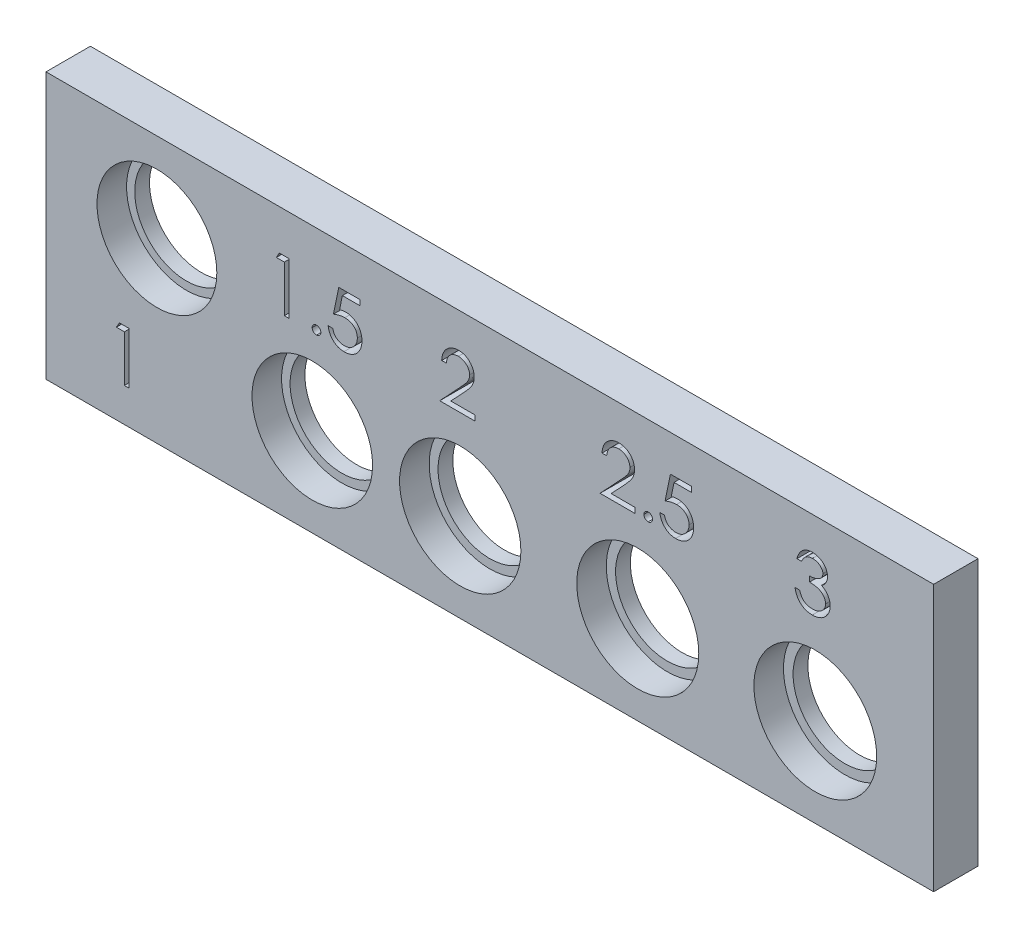
from build123d import *

# Parameters (mm, degrees)
SKETCH1_W           = 60
SKETCH1_H           = 18
BOSS_EXTRUDE1_DEPTH = 3
SKETCH2_R           = 4.05
SKETCH2_R_2         = 4.075
SKETCH2_R_3         = 4.1
SKETCH2_R_4         = 4.125
SKETCH2_R_5         = 4.15
CUT_EXTRUDE1_DEPTH  = 2
SKETCH3_R           = 3.5
CUT_EXTRUDE2_DEPTH  = 63.673758464
CUT_EXTRUDE3_DEPTH  = 63.713634881
CUT_EXTRUDE4_DEPTH  = 63.71363501


with BuildPart() as part:
    # Sketch1 → Boss-Extrude1 (new body)
    with BuildSketch(Plane.XY):
        with Locations((30, 9)):
            Rectangle(SKETCH1_W, SKETCH1_H)
    extrude(amount=BOSS_EXTRUDE1_DEPTH)

    # Sketch2 → Cut-Extrude1 (cut)
    with BuildSketch(Plane.XY.offset(3)):
        with Locations((7.496683546, 12)):
            Circle(SKETCH2_R)
        with Locations((18, 6)):
            Circle(SKETCH2_R_2)
        with Locations((28, 6)):
            Circle(SKETCH2_R_3)
        with Locations((40, 6)):
            Circle(SKETCH2_R_4)
        with Locations((52, 6)):
            Circle(SKETCH2_R_5)
    extrude(amount=-CUT_EXTRUDE1_DEPTH, mode=Mode.SUBTRACT)

    # Sketch3 → Cut-Extrude2 (cut, through all)
    with BuildSketch(Plane.XY.offset(1)):
        with Locations((7.496683546, 12)):
            Circle(SKETCH3_R)
        with Locations((18, 6)):
            Circle(SKETCH3_R)
        with Locations((28, 6)):
            Circle(SKETCH3_R)
        with Locations((40, 6)):
            Circle(SKETCH3_R)
        with Locations((52, 6)):
            Circle(SKETCH3_R)
    extrude(amount=-CUT_EXTRUDE2_DEPTH, mode=Mode.SUBTRACT)

    # Sketch7 → Cut-Extrude3 (cut, through all)
    with BuildSketch(Plane.XY.offset(3)):
        Polygon((15.775424028, 15.278526848), (16.422559444, 15.278526848), (16.422559444, 11.778526848), (16.10845688, 11.778526848), (16.10845688, 14.919552489), (15.569995342, 14.919552489), align=None)
        with BuildLine():
            add(Edge.make_bspline(
                [(18.284738932, 12.316988387), (18.304229144, 12.31583022), (18.342437426, 12.31355977), (18.397676555, 12.297983096), (18.447671214, 12.270324435), (18.492203459, 12.233461657), (18.528909936, 12.188765994), (18.557554288, 12.139170085), (18.572995273, 12.083468493), (18.575249185, 12.045038818), (18.576405598, 12.02532172)],
                knots=[0, 0, 0, 0, 1.020151414, 1.999887582, 2.974338812, 3.990962822, 5.007586832, 5.987933904, 6.967670073, 8, 8, 8, 8], degree=3))
            add(Edge.make_bspline(
                [(18.576405598, 12.02532172), (18.575209998, 12.00607839), (18.57285229, 11.968130827), (18.557589682, 11.912849364), (18.528691632, 11.86322246), (18.492456639, 11.817920321), (18.447660206, 11.780979451), (18.397558359, 11.753556106), (18.342567101, 11.736864126), (18.304250778, 11.734737829), (18.284738932, 11.733655053)],
                knots=[0, 0, 0, 0, 1.009421747, 1.99056486, 2.972319754, 3.999869655, 5.017953583, 5.993804169, 6.978383603, 8, 8, 8, 8], degree=3))
            add(Edge.make_bspline(
                [(18.284738932, 11.733655053), (18.265213026, 11.734698651), (18.227093343, 11.736736026), (18.172307349, 11.753898832), (18.121900381, 11.780722292), (18.077112669, 11.817989202), (18.040574197, 11.862989345), (18.012948814, 11.913191141), (17.996358665, 11.967972579), (17.994176793, 12.006047222), (17.993072265, 12.02532172)],
                knots=[0, 0, 0, 0, 1.022052826, 1.995314843, 2.982371812, 4.00089066, 5.028879526, 6.005146991, 6.990147033, 8, 8, 8, 8], degree=3))
            add(Edge.make_bspline(
                [(17.993072265, 12.02532172), (17.994134364, 12.0450711), (17.996207983, 12.08362934), (18.012983643, 12.138828447), (18.040359855, 12.188996886), (18.07736525, 12.233393467), (18.121889546, 12.270580769), (18.172185751, 12.297645562), (18.227225291, 12.313685975), (18.26523523, 12.315868491), (18.284738932, 12.316988387)],
                knots=[0, 0, 0, 0, 1.032775665, 2.016367738, 2.991239715, 4.008302682, 5.025365648, 6.011011707, 6.979408107, 8, 8, 8, 8], degree=3))
        make_face()
        with BuildLine():
            Line((21.223841496, 15.278526848), (21.223841496, 14.919552489))
            Line((21.223841496, 14.919552489), (20.03403781, 14.919552489))
            Line((20.03403781, 14.919552489), (19.844734925, 13.998979573))
            add(Edge.make_bspline(
                [(19.844734925, 13.998979573), (19.8817908, 14.009209844), (19.953580695, 14.029029378), (20.059540556, 14.051035148), (20.16013276, 14.064300593), (20.22540813, 14.066111903), (20.256994541, 14.066988387)],
                knots=[0, 0, 0, 0, 1.100273476, 2.13160584, 3.095893838, 4, 4, 4, 4], degree=3))
            add(Edge.make_bspline(
                [(20.256994541, 14.066988387), (20.29607828, 14.066142451), (20.372926678, 14.06447913), (20.485365625, 14.048507281), (20.592698518, 14.023367366), (20.694700888, 13.988246844), (20.791561439, 13.943337111), (20.882389, 13.887237171), (20.968546913, 13.82170384), (21.048489507, 13.746358828), (21.121013815, 13.663437211), (21.184779805, 13.57427934), (21.238942395, 13.479751678), (21.28250315, 13.378951069), (21.317287484, 13.272991916), (21.340439479, 13.160759333), (21.355856188, 13.043311213), (21.357578575, 12.963006643), (21.35845688, 12.922056496)],
                knots=[0, 0, 0, 0, 1.052922333, 2.070308379, 3.05430497, 4.020497103, 4.973039431, 5.925935799, 6.892292201, 7.88610001, 8.88166317, 9.857072816, 10.836096531, 11.812156883, 12.81219415, 13.836441305, 14.89672472, 16, 16, 16, 16], degree=3))
            add(Edge.make_bspline(
                [(21.35845688, 12.922056496), (21.357791805, 12.893534275), (21.356470642, 12.836875288), (21.349752055, 12.752731087), (21.336816339, 12.670368254), (21.319448615, 12.589775862), (21.296906197, 12.51110649), (21.269617143, 12.434134962), (21.236221115, 12.359340355), (21.19958974, 12.28601496), (21.158343262, 12.215816453), (21.112564755, 12.150167467), (21.064199263, 12.088083185), (21.012157878, 12.030229452), (20.955956883, 11.976986434), (20.896276916, 11.928038153), (20.833594197, 11.882556822), (20.766938955, 11.842388627), (20.697796472, 11.805425671), (20.625168255, 11.775102134), (20.550707554, 11.747991606), (20.473342678, 11.726382078), (20.393248866, 11.709449523), (20.31029409, 11.697948923), (20.22491342, 11.689572485), (20.167038408, 11.689048128), (20.137803835, 11.688783259)],
                knots=[0, 0, 0, 0, 1.056347294, 2.098418968, 3.122841568, 4.141288669, 5.149314143, 6.15115421, 7.162517403, 8.180376062, 9.185164535, 10.17417709, 11.141909838, 12.097768115, 13.052685741, 14.0056014, 14.954263652, 15.917497458, 16.885230207, 17.854509472, 18.828990115, 19.81800267, 20.826176721, 21.857883937, 22.917946725, 24, 24, 24, 24], degree=3))
            add(Edge.make_bspline(
                [(20.137803835, 11.688783259), (20.102929655, 11.689474097), (20.034318824, 11.690833239), (19.933798257, 11.705051724), (19.837083651, 11.72541564), (19.74495355, 11.75605191), (19.656582286, 11.794439205), (19.573159569, 11.842955376), (19.492553793, 11.89793448), (19.418041756, 11.962814833), (19.348885642, 12.033730515), (19.286979134, 12.110688156), (19.231845557, 12.192417598), (19.18436781, 12.279315752), (19.143869788, 12.371154283), (19.1120548, 12.468277284), (19.086376445, 12.570177288), (19.075513025, 12.640330799), (19.069995342, 12.675962746)],
                knots=[0, 0, 0, 0, 1.0467383, 2.05933395, 3.04377827, 4.011590433, 4.970194871, 5.932262533, 6.905835911, 7.896367577, 8.894135286, 9.877477877, 10.858688626, 11.851381753, 12.8477658, 13.868841284, 14.917554742, 16, 16, 16, 16], degree=3))
            Line((19.069995342, 12.675962746), (19.384097906, 12.675962746))
            add(Edge.make_bspline(
                [(19.384097906, 12.675962746), (19.391826463, 12.642586293), (19.40668118, 12.578434898), (19.439286929, 12.488303557), (19.479152804, 12.407984333), (19.526557152, 12.33641475), (19.583107183, 12.274005753), (19.647636612, 12.218388691), (19.719984335, 12.168213562), (19.800377565, 12.126390794), (19.885190644, 12.090722041), (19.973957854, 12.066970346), (20.0642622, 12.050269453), (20.125340571, 12.048597692), (20.156033002, 12.047757617)],
                knots=[0, 0, 0, 0, 1.136247022, 2.183929868, 3.172523383, 4.106158343, 5.02341133, 5.958108904, 6.928429099, 7.938127109, 8.96079061, 9.975095812, 10.982467395, 12, 12, 12, 12], degree=3))
            add(Edge.make_bspline(
                [(20.156033002, 12.047757617), (20.185991447, 12.048578395), (20.244979869, 12.050194514), (20.331791255, 12.062633526), (20.41560413, 12.081791097), (20.495591486, 12.110460952), (20.573153026, 12.145305671), (20.646326796, 12.190020746), (20.717229674, 12.241480765), (20.783657807, 12.300437395), (20.844497256, 12.36540709), (20.898253377, 12.434884483), (20.943030291, 12.50900133), (20.9807644, 12.586474482), (21.009417699, 12.66815304), (21.02985868, 12.753654215), (21.041861739, 12.843189195), (21.043512919, 12.904258505), (21.044354316, 12.93537781)],
                knots=[0, 0, 0, 0, 1.027316725, 2.022795036, 3.002884548, 3.971462791, 4.93288096, 5.914575861, 6.907176829, 7.935150275, 8.956128384, 9.956726525, 10.942570165, 11.921478529, 12.907843606, 13.90538589, 14.932640048, 16, 16, 16, 16], degree=3))
            add(Edge.make_bspline(
                [(21.044354316, 12.93537781), (21.043695837, 12.963453561), (21.042406957, 13.01840785), (21.031876387, 13.098807057), (21.013559414, 13.174880099), (20.988135534, 13.246994333), (20.955856027, 13.315217776), (20.916409714, 13.379620836), (20.869056316, 13.439354669), (20.814964428, 13.494447223), (20.755706387, 13.545292097), (20.690262644, 13.588636184), (20.620002717, 13.625100102), (20.545773118, 13.6565681), (20.465808219, 13.679168845), (20.381691587, 13.696136731), (20.292514879, 13.705952093), (20.231544191, 13.707313982), (20.200203675, 13.708014028)],
                knots=[0, 0, 0, 0, 1.045622112, 2.046656509, 3.013763289, 3.955457236, 4.890082067, 5.820317437, 6.762574623, 7.722996705, 8.69280354, 9.665887285, 10.63943826, 11.638615906, 12.663482002, 13.728887084, 14.832589034, 16, 16, 16, 16], degree=3))
            add(Edge.make_bspline(
                [(20.200203675, 13.708014028), (20.173074746, 13.707433437), (20.117060391, 13.706234663), (20.031137564, 13.697408166), (19.940845841, 13.683168872), (19.846531346, 13.663582624), (19.747910838, 13.637951548), (19.645192437, 13.607237047), (19.53816017, 13.570515048), (19.466042446, 13.542782835), (19.428969701, 13.528526848)],
                knots=[0, 0, 0, 0, 0.817624296, 1.688186739, 2.600797293, 3.572016777, 4.590301741, 5.671205678, 6.80286297, 8, 8, 8, 8], degree=3))
            Line((19.428969701, 13.528526848), (19.78794406, 15.278526848))
            Line((19.78794406, 15.278526848), (21.223841496, 15.278526848))
        make_face()
        Polygon((4.96392847, 5.787519297), (5.611063886, 5.787519297), (5.611063886, 2.287519297), (5.296961322, 2.287519297), (5.296961322, 5.428544938), (4.758499784, 5.428544938), align=None)
    extrude(amount=-CUT_EXTRUDE3_DEPTH, mode=Mode.SUBTRACT)

    # Sketch6 → Cut-Extrude4 (cut, through all)
    with BuildSketch(Plane.XY.offset(3)):
        with BuildLine():
            Line((27.062031981, 14.476705439), (26.747929417, 14.476705439))
            add(Edge.make_bspline(
                [(26.747929417, 14.476705439), (26.74997657, 14.518376327), (26.753997124, 14.600216842), (26.772825413, 14.719540748), (26.79976629, 14.833595547), (26.837857744, 14.941465461), (26.885164022, 15.044104268), (26.94189405, 15.141104284), (27.0090879, 15.232095473), (27.085294634, 15.316234316), (27.168063273, 15.393421887), (27.257369213, 15.460077129), (27.35121424, 15.516394801), (27.449313639, 15.563476043), (27.552774203, 15.598815889), (27.66065706, 15.625037528), (27.773436197, 15.640813874), (27.850276219, 15.64250966), (27.889355699, 15.643372106)],
                knots=[0, 0, 0, 0, 1.10065271, 2.161652631, 3.183658789, 4.190468796, 5.17591951, 6.163126047, 7.15150782, 8.156236427, 9.156009102, 10.134482811, 11.092018607, 12.041330605, 13.001268258, 13.972401359, 14.968799086, 16, 16, 16, 16], degree=3))
            add(Edge.make_bspline(
                [(27.889355699, 15.643372106), (27.927733773, 15.64247365), (28.003145318, 15.640708215), (28.113207332, 15.625547186), (28.217984627, 15.601801594), (28.317272393, 15.568486178), (28.410278458, 15.52370175), (28.497701502, 15.469904212), (28.580582313, 15.40768438), (28.655189097, 15.334430567), (28.723697176, 15.256228182), (28.782799431, 15.172740279), (28.833412595, 15.086510993), (28.875600274, 14.996882791), (28.906656413, 14.903011763), (28.930234621, 14.80626456), (28.943562035, 14.705639749), (28.945607459, 14.637533194), (28.946647366, 14.602907363)],
                knots=[0, 0, 0, 0, 1.111607364, 2.184268762, 3.212621178, 4.221274766, 5.211760367, 6.196651075, 7.1921475, 8.207485113, 9.220403448, 10.201281604, 11.166441695, 12.114753415, 13.065576456, 14.026450734, 14.996634279, 16, 16, 16, 16], degree=3))
            add(Edge.make_bspline(
                [(28.946647366, 14.602907363), (28.944960721, 14.554157553), (28.941617029, 14.457513425), (28.912761326, 14.315309068), (28.86817923, 14.177404008), (28.8141062, 14.066424956), (28.759485633, 13.977448063), (28.711305837, 13.903532422), (28.653653484, 13.824706005), (28.587056071, 13.740174896), (28.512518265, 13.649680526), (28.429503597, 13.55318576), (28.337377906, 13.451715455), (28.272719725, 13.382409642), (28.239215475, 13.346497106)],
                knots=[0, 0, 0, 0, 1.184203166, 2.347625244, 3.513805382, 4.700623107, 5.337941753, 6.051866363, 6.845199593, 7.711357327, 8.668078039, 9.695487809, 10.805859518, 12, 12, 12, 12], degree=3))
            Line((28.239215475, 13.346497106), (27.363514353, 12.412602875))
            Line((27.363514353, 12.412602875), (28.991519161, 12.412602875))
            Line((28.991519161, 12.412602875), (28.991519161, 12.053628516))
            Line((28.991519161, 12.053628516), (26.613314032, 12.053628516))
            Line((26.613314032, 12.053628516), (27.970685827, 13.502146145))
            add(Edge.make_bspline(
                [(27.970685827, 13.502146145), (28.003733714, 13.536644451), (28.067211941, 13.602908638), (28.156994518, 13.699651598), (28.237633506, 13.789401139), (28.309650899, 13.871987687), (28.371484404, 13.948619255), (28.426356636, 14.016813958), (28.470322227, 14.079568409), (28.518037623, 14.152309023), (28.564251604, 14.24112134), (28.60396396, 14.349655029), (28.628178809, 14.461382282), (28.631083644, 14.536884319), (28.632544802, 14.574862491)],
                knots=[0, 0, 0, 0, 1.329631726, 2.553950428, 3.673215718, 4.687767853, 5.603093632, 6.413772471, 7.123043292, 7.734684054, 8.834405432, 9.900288307, 10.943827018, 12, 12, 12, 12], degree=3))
            add(Edge.make_bspline(
                [(28.632544802, 14.574862491), (28.631909059, 14.598743889), (28.630656133, 14.64580954), (28.619598436, 14.714815299), (28.60288793, 14.781380112), (28.578942672, 14.845708731), (28.547335932, 14.907154384), (28.508862552, 14.965791864), (28.464472488, 15.022480829), (28.413121219, 15.075634127), (28.356709699, 15.124315333), (28.29711545, 15.167439418), (28.234065345, 15.203478529), (28.167825223, 15.233022026), (28.098579754, 15.256197407), (28.026195009, 15.272255987), (27.950870992, 15.28233847), (27.899437497, 15.283702642), (27.873229898, 15.284397747)],
                knots=[0, 0, 0, 0, 0.991446411, 1.95395049, 2.89581595, 3.838931463, 4.798493298, 5.75982156, 6.748411868, 7.785213223, 8.824556874, 9.840280684, 10.836137867, 11.835679398, 12.848801643, 13.863922112, 14.911575587, 16, 16, 16, 16], degree=3))
            add(Edge.make_bspline(
                [(27.873229898, 15.284397747), (27.845859065, 15.283682715), (27.792107269, 15.28227851), (27.713188236, 15.272455846), (27.637902458, 15.255510005), (27.566060555, 15.232333331), (27.49754097, 15.202874782), (27.432676926, 15.166183037), (27.371614036, 15.122399544), (27.314237513, 15.072758988), (27.261373534, 15.017491387), (27.214926658, 14.955881424), (27.174342644, 14.889054008), (27.13893341, 14.817189458), (27.11017772, 14.739635678), (27.08820457, 14.656667973), (27.070817723, 14.568646591), (27.065009203, 14.507861507), (27.062031981, 14.476705439)],
                knots=[0, 0, 0, 0, 1.031018746, 2.02475058, 2.990194455, 3.934040569, 4.864654155, 5.795059489, 6.735614925, 7.690564532, 8.649604399, 9.611025574, 10.590972636, 11.591080095, 12.624614302, 13.701020113, 14.821632451, 16, 16, 16, 16], degree=3))
        make_face()
        with BuildLine():
            Line((37.901037706, 14.476705439), (37.586935142, 14.476705439))
            add(Edge.make_bspline(
                [(37.586935142, 14.476705439), (37.588982295, 14.518376327), (37.593002849, 14.600216842), (37.611831138, 14.719540748), (37.638772015, 14.833595547), (37.676863469, 14.941465461), (37.724169747, 15.044104268), (37.780899775, 15.141104284), (37.848093625, 15.232095473), (37.924300359, 15.316234316), (38.007068998, 15.393421887), (38.096374938, 15.460077129), (38.190219965, 15.516394801), (38.288319364, 15.563476043), (38.391779927, 15.598815889), (38.499662785, 15.625037528), (38.612441922, 15.640813874), (38.689281944, 15.64250966), (38.728361424, 15.643372106)],
                knots=[0, 0, 0, 0, 1.10065271, 2.161652631, 3.183658789, 4.190468796, 5.17591951, 6.163126047, 7.15150782, 8.156236427, 9.156009102, 10.134482811, 11.092018607, 12.041330605, 13.001268258, 13.972401359, 14.968799086, 16, 16, 16, 16], degree=3))
            add(Edge.make_bspline(
                [(38.728361424, 15.643372106), (38.766739498, 15.64247365), (38.842151043, 15.640708215), (38.952213057, 15.625547186), (39.056990352, 15.601801594), (39.156278118, 15.568486178), (39.249284183, 15.52370175), (39.336707227, 15.469904212), (39.419588038, 15.40768438), (39.494194822, 15.334430567), (39.562702901, 15.256228182), (39.621805156, 15.172740279), (39.67241832, 15.086510993), (39.714605999, 14.996882791), (39.745662138, 14.903011763), (39.769240346, 14.80626456), (39.78256776, 14.705639749), (39.784613184, 14.637533194), (39.785653091, 14.602907363)],
                knots=[0, 0, 0, 0, 1.111607364, 2.184268762, 3.212621178, 4.221274766, 5.211760367, 6.196651075, 7.1921475, 8.207485113, 9.220403448, 10.201281604, 11.166441695, 12.114753415, 13.065576456, 14.026450734, 14.996634279, 16, 16, 16, 16], degree=3))
            add(Edge.make_bspline(
                [(39.785653091, 14.602907363), (39.783966446, 14.554157553), (39.780622754, 14.457513425), (39.751767051, 14.315309068), (39.707184954, 14.177404008), (39.653111925, 14.066424956), (39.598491358, 13.977448063), (39.550311562, 13.903532422), (39.492659209, 13.824706005), (39.426061796, 13.740174896), (39.351523989, 13.649680526), (39.268509322, 13.55318576), (39.176383631, 13.451715455), (39.11172545, 13.382409642), (39.0782212, 13.346497106)],
                knots=[0, 0, 0, 0, 1.184203166, 2.347625244, 3.513805382, 4.700623107, 5.337941753, 6.051866363, 6.845199593, 7.711357327, 8.668078039, 9.695487809, 10.805859518, 12, 12, 12, 12], degree=3))
            Line((39.0782212, 13.346497106), (38.202520078, 12.412602875))
            Line((38.202520078, 12.412602875), (39.830524885, 12.412602875))
            Line((39.830524885, 12.412602875), (39.830524885, 12.053628516))
            Line((39.830524885, 12.053628516), (37.452319757, 12.053628516))
            Line((37.452319757, 12.053628516), (38.809691552, 13.502146145))
            add(Edge.make_bspline(
                [(38.809691552, 13.502146145), (38.842739439, 13.536644451), (38.906217666, 13.602908638), (38.996000243, 13.699651598), (39.076639231, 13.789401139), (39.148656624, 13.871987687), (39.210490129, 13.948619255), (39.265362361, 14.016813958), (39.309327952, 14.079568409), (39.357043348, 14.152309023), (39.403257329, 14.24112134), (39.442969685, 14.349655029), (39.467184534, 14.461382282), (39.470089369, 14.536884319), (39.471550527, 14.574862491)],
                knots=[0, 0, 0, 0, 1.329631726, 2.553950428, 3.673215718, 4.687767853, 5.603093632, 6.413772471, 7.123043292, 7.734684054, 8.834405432, 9.900288307, 10.943827018, 12, 12, 12, 12], degree=3))
            add(Edge.make_bspline(
                [(39.471550527, 14.574862491), (39.470914784, 14.598743889), (39.469661858, 14.64580954), (39.458604161, 14.714815299), (39.441893655, 14.781380112), (39.417948397, 14.845708731), (39.386341656, 14.907154384), (39.347868277, 14.965791864), (39.303478213, 15.022480829), (39.252126944, 15.075634127), (39.195715424, 15.124315333), (39.136121174, 15.167439418), (39.07307107, 15.203478529), (39.006830948, 15.233022026), (38.937585479, 15.256197407), (38.865200733, 15.272255987), (38.789876717, 15.28233847), (38.738443221, 15.283702642), (38.712235623, 15.284397747)],
                knots=[0, 0, 0, 0, 0.991446411, 1.95395049, 2.89581595, 3.838931463, 4.798493298, 5.75982156, 6.748411868, 7.785213223, 8.824556874, 9.840280684, 10.836137867, 11.835679398, 12.848801643, 13.863922112, 14.911575587, 16, 16, 16, 16], degree=3))
            add(Edge.make_bspline(
                [(38.712235623, 15.284397747), (38.68486479, 15.283682715), (38.631112994, 15.28227851), (38.552193961, 15.272455846), (38.476908183, 15.255510005), (38.40506628, 15.232333331), (38.336546694, 15.202874782), (38.27168265, 15.166183037), (38.210619761, 15.122399544), (38.153243238, 15.072758988), (38.100379259, 15.017491387), (38.053932383, 14.955881424), (38.013348369, 14.889054008), (37.977939135, 14.817189458), (37.949183445, 14.739635678), (37.927210295, 14.656667973), (37.909823448, 14.568646591), (37.904014927, 14.507861507), (37.901037706, 14.476705439)],
                knots=[0, 0, 0, 0, 1.031018746, 2.02475058, 2.990194455, 3.934040569, 4.864654155, 5.795059489, 6.735614925, 7.690564532, 8.649604399, 9.611025574, 10.590972636, 11.591080095, 12.624614302, 13.701020113, 14.821632451, 16, 16, 16, 16], degree=3))
        make_face()
        with BuildLine():
            add(Edge.make_bspline(
                [(40.705524885, 12.592090055), (40.725015098, 12.590931888), (40.76322338, 12.588661438), (40.818462508, 12.573084764), (40.868457168, 12.545426104), (40.912989413, 12.508563325), (40.949695889, 12.463867662), (40.978340242, 12.414271753), (40.993781227, 12.358570161), (40.996035139, 12.320140486), (40.997191552, 12.300423388)],
                knots=[0, 0, 0, 0, 1.020151414, 1.999887582, 2.974338812, 3.990962822, 5.007586832, 5.987933904, 6.967670073, 8, 8, 8, 8], degree=3))
            add(Edge.make_bspline(
                [(40.997191552, 12.300423388), (40.995995951, 12.281180058), (40.993638244, 12.243232495), (40.978375636, 12.187951032), (40.949477586, 12.138324128), (40.913242593, 12.09302199), (40.868446159, 12.056081119), (40.818344313, 12.028657774), (40.763353055, 12.011965794), (40.725036732, 12.009839497), (40.705524885, 12.008756722)],
                knots=[0, 0, 0, 0, 1.009421747, 1.99056486, 2.972319754, 3.999869655, 5.017953583, 5.993804169, 6.978383603, 8, 8, 8, 8], degree=3))
            add(Edge.make_bspline(
                [(40.705524885, 12.008756722), (40.68599898, 12.009800319), (40.647879297, 12.011837694), (40.593093303, 12.0290005), (40.542686334, 12.05582396), (40.497898623, 12.09309087), (40.461360151, 12.138091013), (40.433734768, 12.18829281), (40.417144619, 12.243074247), (40.414962747, 12.28114889), (40.413858219, 12.300423388)],
                knots=[0, 0, 0, 0, 1.022052826, 1.995314843, 2.982371812, 4.00089066, 5.028879526, 6.005146991, 6.990147033, 8, 8, 8, 8], degree=3))
            add(Edge.make_bspline(
                [(40.413858219, 12.300423388), (40.414920318, 12.320172768), (40.416993937, 12.358731008), (40.433769597, 12.413930115), (40.461145809, 12.464098555), (40.498151204, 12.508495135), (40.5426755, 12.545682437), (40.592971705, 12.572747231), (40.648011245, 12.588787643), (40.686021183, 12.590970159), (40.705524885, 12.592090055)],
                knots=[0, 0, 0, 0, 1.032775665, 2.016367738, 2.991239715, 4.008302682, 5.025365648, 6.011011707, 6.979408107, 8, 8, 8, 8], degree=3))
        make_face()
        with BuildLine():
            Line((43.64462745, 15.553628516), (43.64462745, 15.194654157))
            Line((43.64462745, 15.194654157), (42.454823764, 15.194654157))
            Line((42.454823764, 15.194654157), (42.265520879, 14.274081241))
            add(Edge.make_bspline(
                [(42.265520879, 14.274081241), (42.302576753, 14.284311513), (42.374366649, 14.304131046), (42.48032651, 14.326136817), (42.580918714, 14.339402261), (42.646194084, 14.341213571), (42.677780494, 14.342090055)],
                knots=[0, 0, 0, 0, 1.100273476, 2.13160584, 3.095893838, 4, 4, 4, 4], degree=3))
            add(Edge.make_bspline(
                [(42.677780494, 14.342090055), (42.716864234, 14.341244119), (42.793712631, 14.339580798), (42.906151578, 14.323608949), (43.013484472, 14.298469034), (43.115486842, 14.263348512), (43.212347393, 14.218438779), (43.303174954, 14.162338839), (43.389332867, 14.096805508), (43.469275461, 14.021460496), (43.541799769, 13.938538879), (43.605565759, 13.849381008), (43.659728349, 13.754853346), (43.703289104, 13.654052737), (43.738073438, 13.548093584), (43.761225433, 13.435861001), (43.776642142, 13.318412881), (43.778364528, 13.238108311), (43.779242834, 13.197158164)],
                knots=[0, 0, 0, 0, 1.052922333, 2.070308379, 3.05430497, 4.020497103, 4.973039431, 5.925935799, 6.892292201, 7.88610001, 8.88166317, 9.857072816, 10.836096531, 11.812156883, 12.81219415, 13.836441305, 14.89672472, 16, 16, 16, 16], degree=3))
            add(Edge.make_bspline(
                [(43.779242834, 13.197158164), (43.778577759, 13.168635943), (43.777256596, 13.111976956), (43.770538009, 13.027832755), (43.757602293, 12.945469922), (43.740234568, 12.86487753), (43.717692151, 12.786208158), (43.690403097, 12.70923663), (43.657007069, 12.634442023), (43.620375694, 12.561116628), (43.579129216, 12.490918121), (43.533350708, 12.425269135), (43.484985217, 12.363184853), (43.432943832, 12.30533112), (43.376742837, 12.252088102), (43.31706287, 12.203139821), (43.254380151, 12.157658491), (43.187724908, 12.117490295), (43.118582426, 12.080527339), (43.045954208, 12.050203802), (42.971493508, 12.023093274), (42.894128632, 12.001483746), (42.81403482, 11.984551192), (42.731080044, 11.973050591), (42.645699374, 11.964674154), (42.587824362, 11.964149797), (42.558589789, 11.963884927)],
                knots=[0, 0, 0, 0, 1.056347294, 2.098418968, 3.122841568, 4.141288669, 5.149314143, 6.15115421, 7.162517403, 8.180376062, 9.185164535, 10.17417709, 11.141909838, 12.097768115, 13.052685741, 14.0056014, 14.954263652, 15.917497458, 16.885230207, 17.854509472, 18.828990115, 19.81800267, 20.826176721, 21.857883937, 22.917946725, 24, 24, 24, 24], degree=3))
            add(Edge.make_bspline(
                [(42.558589789, 11.963884927), (42.523715609, 11.964575765), (42.455104778, 11.965934907), (42.354584211, 11.980153392), (42.257869605, 12.000517308), (42.165739504, 12.031153578), (42.07736824, 12.069540873), (41.993945523, 12.118057044), (41.913339746, 12.173036148), (41.83882771, 12.237916501), (41.769671596, 12.308832183), (41.707765087, 12.385789824), (41.652631511, 12.467519266), (41.605153764, 12.554417421), (41.564655742, 12.646255951), (41.532840754, 12.743378952), (41.507162399, 12.845278956), (41.496298979, 12.915432467), (41.490781296, 12.951064414)],
                knots=[0, 0, 0, 0, 1.0467383, 2.05933395, 3.04377827, 4.011590433, 4.970194871, 5.932262533, 6.905835911, 7.896367577, 8.894135286, 9.877477877, 10.858688626, 11.851381753, 12.8477658, 13.868841284, 14.917554742, 16, 16, 16, 16], degree=3))
            Line((41.490781296, 12.951064414), (41.80488386, 12.951064414))
            add(Edge.make_bspline(
                [(41.80488386, 12.951064414), (41.812612417, 12.917687961), (41.827467134, 12.853536567), (41.860072882, 12.763405225), (41.899938758, 12.683086002), (41.947343106, 12.611516418), (42.003893137, 12.549107421), (42.068422566, 12.493490359), (42.140770289, 12.44331523), (42.221163518, 12.401492463), (42.305976598, 12.365823709), (42.394743808, 12.342072014), (42.485048154, 12.325371121), (42.546126524, 12.323699361), (42.576818956, 12.322859286)],
                knots=[0, 0, 0, 0, 1.136247022, 2.183929868, 3.172523383, 4.106158343, 5.02341133, 5.958108904, 6.928429099, 7.938127109, 8.96079061, 9.975095812, 10.982467395, 12, 12, 12, 12], degree=3))
            add(Edge.make_bspline(
                [(42.576818956, 12.322859286), (42.6067774, 12.323680064), (42.665765823, 12.325296182), (42.752577209, 12.337735194), (42.836390083, 12.356892765), (42.91637744, 12.38556262), (42.99393898, 12.420407339), (43.06711275, 12.465122415), (43.138015627, 12.516582433), (43.204443761, 12.575539063), (43.26528321, 12.640508758), (43.319039331, 12.709986151), (43.363816245, 12.784102998), (43.401550354, 12.861576151), (43.430203652, 12.943254708), (43.450644634, 13.028755883), (43.462647692, 13.118290863), (43.464298872, 13.179360173), (43.46514027, 13.210479478)],
                knots=[0, 0, 0, 0, 1.027316725, 2.022795036, 3.002884548, 3.971462791, 4.93288096, 5.914575861, 6.907176829, 7.935150275, 8.956128384, 9.956726525, 10.942570165, 11.921478529, 12.907843606, 13.90538589, 14.932640048, 16, 16, 16, 16], degree=3))
            add(Edge.make_bspline(
                [(43.46514027, 13.210479478), (43.464481791, 13.23855523), (43.463192911, 13.293509519), (43.45266234, 13.373908725), (43.434345368, 13.449981767), (43.408921488, 13.522096001), (43.37664198, 13.590319444), (43.337195668, 13.654722504), (43.28984227, 13.714456337), (43.235750382, 13.769548891), (43.176492341, 13.820393766), (43.111048598, 13.863737852), (43.040788671, 13.90020177), (42.966559072, 13.931669768), (42.886594173, 13.954270513), (42.802477541, 13.971238399), (42.713300833, 13.981053762), (42.652330145, 13.98241565), (42.620989629, 13.983115696)],
                knots=[0, 0, 0, 0, 1.045622112, 2.046656509, 3.013763289, 3.955457236, 4.890082067, 5.820317437, 6.762574623, 7.722996705, 8.69280354, 9.665887285, 10.63943826, 11.638615906, 12.663482002, 13.728887084, 14.832589034, 16, 16, 16, 16], degree=3))
            add(Edge.make_bspline(
                [(42.620989629, 13.983115696), (42.5938607, 13.982535105), (42.537846345, 13.981336331), (42.451923518, 13.972509834), (42.361631795, 13.95827054), (42.2673173, 13.938684293), (42.168696792, 13.913053216), (42.065978391, 13.882338715), (41.958946124, 13.845616716), (41.8868284, 13.817884503), (41.849755655, 13.803628516)],
                knots=[0, 0, 0, 0, 0.817624296, 1.688186739, 2.600797293, 3.572016777, 4.590301741, 5.671205678, 6.80286297, 8, 8, 8, 8], degree=3))
            Line((41.849755655, 13.803628516), (42.208730014, 15.553628516))
            Line((42.208730014, 15.553628516), (43.64462745, 15.553628516))
        make_face()
        with BuildLine():
            Line((51.07840761, 14.883487043), (50.764305046, 14.883487043))
            add(Edge.make_bspline(
                [(50.764305046, 14.883487043), (50.772814597, 14.918719527), (50.789450072, 14.987596151), (50.824147646, 15.086003412), (50.861946901, 15.179126933), (50.907336006, 15.265223007), (50.95684476, 15.34602191), (51.013567481, 15.419691034), (51.074887204, 15.488104), (51.142712153, 15.548817237), (51.213840815, 15.603794967), (51.289275435, 15.650670024), (51.367498328, 15.690994177), (51.449051461, 15.724214409), (51.534177633, 15.749239932), (51.622107256, 15.767396738), (51.713070756, 15.779187852), (51.774818347, 15.780338615), (51.806172033, 15.78092294)],
                knots=[0, 0, 0, 0, 1.162005537, 2.271625781, 3.343758855, 4.383309926, 5.390229558, 6.379919256, 7.361854164, 8.333198761, 9.295911338, 10.242430842, 11.177959212, 12.116337295, 13.062827104, 14.020064771, 14.994644689, 16, 16, 16, 16], degree=3))
            add(Edge.make_bspline(
                [(51.806172033, 15.78092294), (51.851854775, 15.77954371), (51.942223786, 15.776815335), (52.074986833, 15.751900898), (52.203013652, 15.712475766), (52.3249029, 15.658002039), (52.438121333, 15.590814725), (52.538857519, 15.510849988), (52.62574603, 15.419650687), (52.698640408, 15.318918123), (52.755715407, 15.211262613), (52.79780178, 15.100462456), (52.823423461, 14.986780485), (52.826744018, 14.910023206), (52.82840761, 14.871567972)],
                knots=[0, 0, 0, 0, 1.083050992, 2.142477498, 3.193116406, 4.255571735, 5.30263384, 6.308962982, 7.297363603, 8.282367274, 9.249857812, 10.179914175, 11.08814088, 12, 12, 12, 12], degree=3))
            add(Edge.make_bspline(
                [(52.82840761, 14.871567972), (52.827244019, 14.834561178), (52.824967052, 14.762144623), (52.805633346, 14.656423126), (52.773097084, 14.556781526), (52.728027321, 14.462800364), (52.669685771, 14.375075524), (52.599013074, 14.293409633), (52.515510412, 14.217440475), (52.452231474, 14.173921002), (52.419653604, 14.151515889)],
                knots=[0, 0, 0, 0, 1.024540389, 2.004866551, 2.965041327, 3.920577974, 4.882998113, 5.874504559, 6.905732034, 8, 8, 8, 8], degree=3))
            add(Edge.make_bspline(
                [(52.419653604, 14.151515889), (52.456885358, 14.133537717), (52.530652233, 14.09791776), (52.631202762, 14.028062002), (52.722480637, 13.947405655), (52.773384356, 13.884463002), (52.798960495, 13.852838004)],
                knots=[0, 0, 0, 0, 1.015518401, 2.012035669, 3.001164323, 4, 4, 4, 4], degree=3))
            add(Edge.make_bspline(
                [(52.798960495, 13.852838004), (52.815801837, 13.829780253), (52.849208733, 13.784042336), (52.890444267, 13.71050591), (52.927853381, 13.636154421), (52.957003601, 13.558995015), (52.979577467, 13.479922001), (52.9957135, 13.398799605), (53.005737641, 13.315561583), (53.007173193, 13.259249103), (53.00789479, 13.230942972)],
                knots=[0, 0, 0, 0, 1.025084078, 2.033381695, 3.024893161, 4.013698104, 4.991890475, 5.976764909, 6.982997093, 8, 8, 8, 8], degree=3))
            add(Edge.make_bspline(
                [(53.00789479, 13.230942972), (53.006100276, 13.181933251), (53.002519694, 13.084144449), (52.97051562, 12.939669728), (52.920902379, 12.798444225), (52.850445443, 12.663369386), (52.764577934, 12.536989005), (52.66242061, 12.423912696), (52.545134202, 12.326714092), (52.414328553, 12.245503864), (52.272611424, 12.180585941), (52.121035832, 12.135528499), (51.961785778, 12.106182499), (51.852578481, 12.10303563), (51.79705745, 12.101435761)],
                knots=[0, 0, 0, 0, 0.955779014, 1.907060117, 2.875433937, 3.871313158, 4.872415639, 5.851225146, 6.836215519, 7.83643374, 8.849228613, 9.86973379, 10.916971861, 12, 12, 12, 12], degree=3))
            add(Edge.make_bspline(
                [(51.79705745, 12.101435761), (51.75963815, 12.102303974), (51.686009445, 12.104012328), (51.577765946, 12.115690929), (51.474444247, 12.137020935), (51.375904649, 12.16572424), (51.282059613, 12.202115982), (51.193195507, 12.24743468), (51.108765614, 12.300746182), (51.029566663, 12.36267977), (50.955608095, 12.43196111), (50.888855371, 12.50982012), (50.828195578, 12.594817524), (50.775252939, 12.68794058), (50.727615986, 12.787985837), (50.68843503, 12.896234335), (50.653949461, 13.011718357), (50.637915997, 13.092196098), (50.629689661, 13.133487043)],
                knots=[0, 0, 0, 0, 1.048658725, 2.063410685, 3.046034179, 4.001477787, 4.936774919, 5.862367409, 6.792675028, 7.730719943, 8.675894397, 9.627829632, 10.600096036, 11.597688215, 12.626045268, 13.701542398, 14.82072376, 16, 16, 16, 16], degree=3))
            Line((50.629689661, 13.133487043), (50.943792226, 13.133487043))
            add(Edge.make_bspline(
                [(50.943792226, 13.133487043), (50.951975517, 13.10653803), (50.96789273, 13.054119858), (50.994987028, 12.978679552), (51.0258553, 12.909521499), (51.058969858, 12.846138377), (51.093748304, 12.787905975), (51.13266323, 12.736364106), (51.172832375, 12.689248903), (51.203111728, 12.662704291), (51.217930847, 12.649713004)],
                knots=[0, 0, 0, 0, 1.198163088, 2.33053128, 3.407730985, 4.417276592, 5.372219308, 6.28897303, 7.162600585, 8, 8, 8, 8], degree=3))
            add(Edge.make_bspline(
                [(51.217930847, 12.649713004), (51.237527424, 12.63460467), (51.276660087, 12.604434639), (51.340428318, 12.56593301), (51.407493204, 12.532571985), (51.479307878, 12.507088289), (51.554322649, 12.485510628), (51.633750014, 12.471390109), (51.716889231, 12.461701938), (51.773656994, 12.460847006), (51.802666424, 12.46041012)],
                knots=[0, 0, 0, 0, 0.946170439, 1.889420265, 2.845303464, 3.807233317, 4.801018734, 5.828864929, 6.890507805, 8, 8, 8, 8], degree=3))
            add(Edge.make_bspline(
                [(51.802666424, 12.46041012), (51.835419927, 12.461026025), (51.899466574, 12.462230375), (51.992921433, 12.473306081), (52.081828881, 12.489436495), (52.165201806, 12.514349478), (52.244132314, 12.545130329), (52.317513963, 12.583778735), (52.38631007, 12.629123456), (52.449639475, 12.680662615), (52.506584983, 12.73708411), (52.556724496, 12.796097181), (52.599349157, 12.85745301), (52.633732736, 12.921491131), (52.660883286, 12.98794636), (52.679366486, 13.05700519), (52.692218001, 13.128102456), (52.693264614, 13.176431425), (52.693792226, 13.200794735)],
                knots=[0, 0, 0, 0, 1.217147791, 2.380027433, 3.494444702, 4.572153297, 5.609568379, 6.639424714, 7.649109417, 8.668170816, 9.669597737, 10.625200337, 11.543417969, 12.441394052, 13.322311151, 14.205496177, 15.095365482, 16, 16, 16, 16], degree=3))
            add(Edge.make_bspline(
                [(52.693792226, 13.200794735), (52.692261924, 13.233406074), (52.689208936, 13.298466482), (52.665900356, 13.394184057), (52.627561492, 13.486407469), (52.573888981, 13.573563259), (52.508553252, 13.654339161), (52.432188345, 13.726410643), (52.344160117, 13.785880734), (52.263140248, 13.82696939), (52.191375091, 13.855006466), (52.129959707, 13.87368143), (52.061203103, 13.889495086), (51.985936754, 13.904207357), (51.903593538, 13.916728705), (51.8142631, 13.927170521), (51.717927338, 13.935525562), (51.651236173, 13.939256657), (51.616869149, 13.94117935)],
                knots=[0, 0, 0, 0, 1.07054697, 2.135767047, 3.216561865, 4.33974944, 5.486079747, 6.621378074, 7.775625952, 8.963672916, 9.598146892, 10.304877434, 11.070270905, 11.915000392, 12.823868403, 13.805723172, 14.86925407, 16, 16, 16, 16], degree=3))
            Line((51.616869149, 13.94117935), (51.616869149, 14.300153709))
            add(Edge.make_bspline(
                [(51.616869149, 14.300153709), (51.660170314, 14.300888513), (51.744986661, 14.302327813), (51.868880966, 14.319735824), (51.987354278, 14.343816452), (52.09778102, 14.380701644), (52.198429733, 14.423541941), (52.285749335, 14.47339415), (52.358516482, 14.5288089), (52.416377554, 14.590641509), (52.459906783, 14.656956556), (52.49173358, 14.726073214), (52.510533906, 14.798597275), (52.513043573, 14.848091943), (52.514305046, 14.872970216)],
                knots=[0, 0, 0, 0, 1.321986639, 2.589447074, 3.816329219, 5.01088745, 6.139805852, 7.153945165, 8.075214402, 8.924034688, 9.728124013, 10.488707548, 11.240355623, 12, 12, 12, 12], degree=3))
            add(Edge.make_bspline(
                [(52.514305046, 14.872970216), (52.513890635, 14.891247961), (52.513066184, 14.927610668), (52.502668906, 14.980735737), (52.487044865, 15.032236683), (52.465565136, 15.081894493), (52.436814937, 15.129364767), (52.402408951, 15.175052216), (52.361440851, 15.218695995), (52.314495404, 15.259376314), (52.264083599, 15.298145552), (52.208833824, 15.331059189), (52.150411949, 15.359204251), (52.088753294, 15.382413753), (52.023657764, 15.399873041), (51.955431206, 15.412408882), (51.883943522, 15.420246537), (51.83517179, 15.421374953), (51.810378764, 15.421948581)],
                knots=[0, 0, 0, 0, 0.884392785, 1.759457502, 2.611959086, 3.489218968, 4.37281399, 5.2945488, 6.255912374, 7.266815255, 8.301784654, 9.332968512, 10.37626691, 11.440494194, 12.520033166, 13.637162961, 14.798855837, 16, 16, 16, 16], degree=3))
            add(Edge.make_bspline(
                [(51.810378764, 15.421948581), (51.770527096, 15.420557219), (51.69268752, 15.417839566), (51.580472603, 15.394036552), (51.476153269, 15.356058469), (51.396414602, 15.310725449), (51.337532028, 15.265975015), (51.29545509, 15.226892629), (51.254134579, 15.183459805), (51.216288902, 15.13300143), (51.178014926, 15.07893464), (51.143170364, 15.018510958), (51.109310672, 14.953306564), (51.088908122, 14.90721093), (51.07840761, 14.883487043)],
                knots=[0, 0, 0, 0, 1.472543308, 2.876219568, 4.221790263, 5.565193594, 6.249813518, 6.953379497, 7.687249741, 8.463570142, 9.283606569, 10.136032583, 11.040678096, 12, 12, 12, 12], degree=3))
        make_face()
    extrude(amount=-CUT_EXTRUDE4_DEPTH, mode=Mode.SUBTRACT)


solid = part.part
